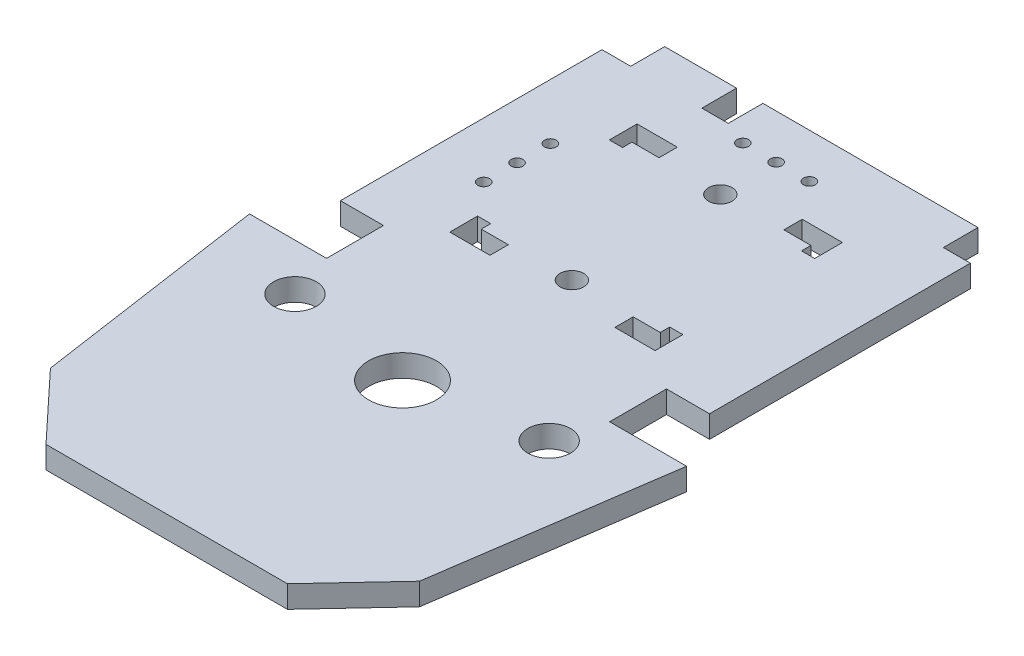
from build123d import *

# Parameters (mm, degrees)
SKETCH1_R           = 1.54
SKETCH1_R_2         = 2.443409063
SKETCH1_R_3         = 0.85
SKETCH1_R_4         = 0.425
BOSS_EXTRUDE1_DEPTH = 1.6


with BuildPart() as part:
    # Sketch1 → Boss-Extrude1 (new body)
    with BuildSketch(Plane(origin=(0, 0, 0), x_dir=(1, 0, 0), z_dir=(0, 1, 0))):
        Polygon((2.07, 0), (2.07, -2.45), (0, -2.45), (0, -21.3), (3.1, -21.3), (3.1, -25.4), (0, -25.4), (-2.45, -25.4), (0, -42.2), (4.6, -47.12), (22, -47.12), (26.6, -42.2), (29.05, -25.4), (26.6, -25.4), (23.5, -25.4), (23.5, -21.3), (26.6, -21.3), (26.6, -2.5), (24.65, -2.5), (24.65, 0), (9.15, 0), (9.15, -2.5), (7.25, -2.5), (7.25, 0), align=None)
        with Locations(Location((22.51, -28.768011283, 0), (0, 0, 270))):
            Circle(SKETCH1_R, mode=Mode.SUBTRACT)
        with Locations(Location((4.19, -28.768011283, 0), (0, 0, 270))):
            Circle(SKETCH1_R, mode=Mode.SUBTRACT)
        with Locations(Location((13.451347261, -30.276590937, 0), (0, 0, 270))):
            Circle(SKETCH1_R_2, mode=Mode.SUBTRACT)
        with Locations(Location((13.3, -7.22, 0), (0, 0, 270))):
            Circle(SKETCH1_R_3, mode=Mode.SUBTRACT)
        with Locations(Location((13.3, -17.92, 0), (0, 0, 270))):
            Circle(SKETCH1_R_3, mode=Mode.SUBTRACT)
        with Locations(Location((13.3, -3.2, 0), (0, 0, 270))):
            Circle(SKETCH1_R_4, mode=Mode.SUBTRACT)
        with Locations(Location((15.7, -3.2, 0), (0, 0, 270))):
            Circle(SKETCH1_R_4, mode=Mode.SUBTRACT)
        with Locations(Location((10.9, -3.2, 0), (0, 0, 270))):
            Circle(SKETCH1_R_4, mode=Mode.SUBTRACT)
        with Locations(Location((4, -14.97, 0), (0, 0, 270))):
            Circle(SKETCH1_R_4, mode=Mode.SUBTRACT)
        with Locations(Location((4, -12.57, 0), (0, 0, 270))):
            Circle(SKETCH1_R_4, mode=Mode.SUBTRACT)
        with Locations(Location((4, -10.17, 0), (0, 0, 270))):
            Circle(SKETCH1_R_4, mode=Mode.SUBTRACT)
        Polygon((20.7, -19.32), (20.7, -17.32), (19.75, -17.32), (19.75, -18), (17.8, -18), (17.8, -19.32), align=None, mode=Mode.SUBTRACT)
        Polygon((8.8, -19.32), (5.9, -19.32), (5.9, -17.32), (6.85, -17.32), (6.85, -18), (8.8, -18), align=None, mode=Mode.SUBTRACT)
        Polygon((17.8, -5.82), (20.7, -5.82), (20.7, -7.82), (19.75, -7.82), (19.75, -7.14), (17.8, -7.14), align=None, mode=Mode.SUBTRACT)
        Polygon((5.9, -5.82), (5.9, -7.82), (6.85, -7.82), (6.85, -7.14), (8.8, -7.14), (8.8, -5.82), align=None, mode=Mode.SUBTRACT)
    extrude(amount=BOSS_EXTRUDE1_DEPTH)


solid = part.part
